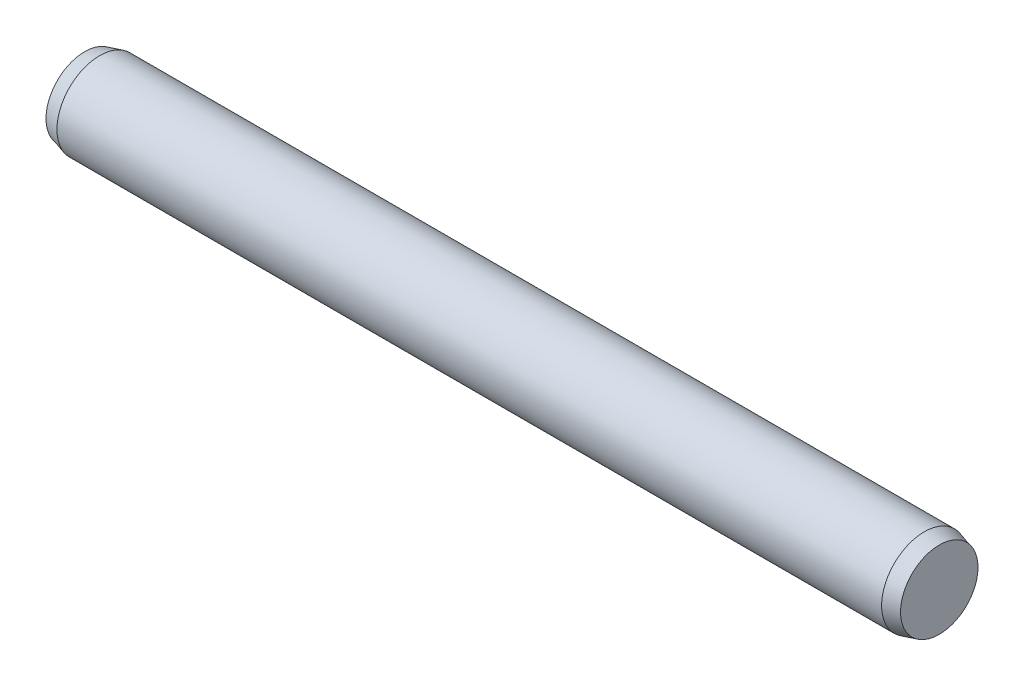
from build123d import *

# Parameters (mm, degrees)
EXTRUDE1_DEPTH      = 9.65
EXTRUDE1_DEPTH_BACK = 9.65
SKETCH2_R           = 1
SKETCH3_R           = 1
EXTRUDE2_DEPTH      = 0.35
EXTRUDE2_TAPER      = 15
SKETCH4_R           = 1
EXTRUDE3_DEPTH      = 0.35
EXTRUDE3_TAPER      = 15


with BuildPart() as part:
    # Sketch2 → Extrude1 (new, two sides: drawn at the far end of the back side and taken through both)
    with BuildSketch(Plane(origin=(0, 0, 0), x_dir=(0, 0, -1), z_dir=(1, 0, 0)).offset(-EXTRUDE1_DEPTH_BACK)):
        Circle(SKETCH2_R)
    extrude(amount=EXTRUDE1_DEPTH + EXTRUDE1_DEPTH_BACK)

    # Sketch3 → Extrude2 (add)
    with BuildSketch(Plane(origin=(9.65, 0, 0), x_dir=(0, 0, -1), z_dir=(1, 0, 0))):
        Circle(SKETCH3_R)
    extrude(amount=EXTRUDE2_DEPTH, taper=EXTRUDE2_TAPER)

    # Sketch4 → Extrude3 (add)
    with BuildSketch(Plane.ZY.offset(9.65)):
        with Locations(Location((0, 0, 0), (0, 0, 180))):
            Circle(SKETCH4_R)
    extrude(amount=EXTRUDE3_DEPTH, taper=EXTRUDE3_TAPER)


solid = part.part
